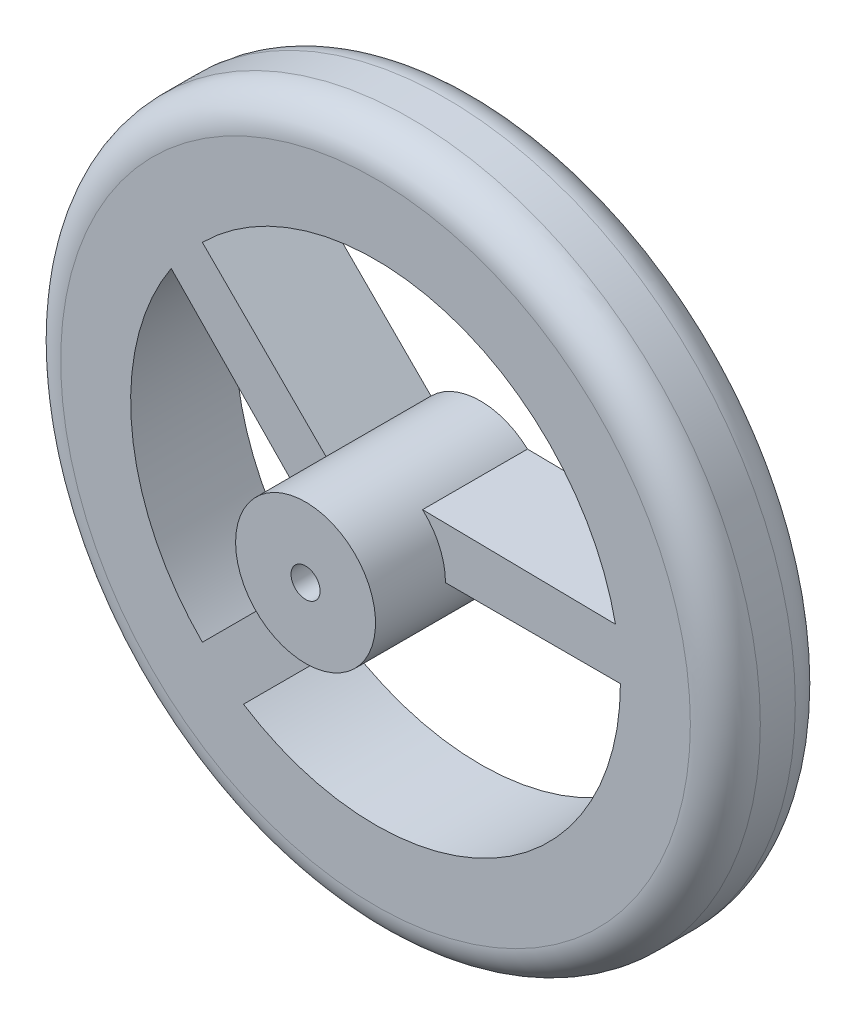
from build123d import *

# Parameters (mm, degrees)
SKETCH1_R           = 100
BOSS_EXTRUDE1_DEPTH = 30
FILLET2_R           = 10
SKETCH2_R           = 20
SKETCH2_R_2         = 4.15
BOSS_EXTRUDE2_DEPTH = 50
SCALE1_SCALE        = 0.05
SCALE2_SCALE        = 6


with BuildPart() as part:
    # Sketch1 → Boss-Extrude1 (new body)
    with BuildSketch(Plane.XY):
        Circle(SKETCH1_R)
        with BuildLine():
            Line((-10.606601718, -10.606601718), (-49.497474683, -49.497474683))
            ThreePointArc((-49.497474683, -49.497474683), (-69.64553071, -7.03562734), (-58.396917549, 38.597927675))
            Line((-58.396917549, 38.597927675), (-10.606601718, -10.606601718))
        make_face(mode=Mode.SUBTRACT)
        with BuildLine():
            ThreePointArc((10.606601718, -10.606601718), (13.858192988, -5.740251485), (15, 0))
            Line((15, 0), (70, 0))
            ThreePointArc((70, 0), (33.601511791, -61.407966954), (-37.741097297, -58.954300732))
            Line((-37.741097297, -58.954300732), (10.606601718, -10.606601718))
        make_face(mode=Mode.SUBTRACT)
        with BuildLine():
            ThreePointArc((0, 15), (-5.740251485, 13.858192988), (-10.606601718, 10.606601718))
            Line((-10.606601718, 10.606601718), (-49.497474683, 49.497474683))
            ThreePointArc((-49.497474683, 49.497474683), (20.152118643, 67.036498374), (68.585712798, 14))
            Line((68.585712798, 14), (0, 15))
        make_face(mode=Mode.SUBTRACT)
    extrude(amount=BOSS_EXTRUDE1_DEPTH)

    # Fillet2
    fillet2_edges = [part.edges().sort_by_distance(p)[0] for p in [
        (-100, 0, 0),
        (-100, 0, 30),
    ]]
    fillet(fillet2_edges, radius=FILLET2_R)

    # Sketch2 → Boss-Extrude2 (add)
    with BuildSketch(Plane(origin=(0, 0, 0), x_dir=(-1, 0, 0), z_dir=(0, 0, -1))):
        Circle(SKETCH2_R)
        Circle(SKETCH2_R_2, mode=Mode.SUBTRACT)
    extrude(amount=-BOSS_EXTRUDE2_DEPTH)


with BuildPart() as part_1:
    # Scale1: scaled about (-0.724367868, -0.188947022, 16.030178363)
    add(part.part.scale(SCALE1_SCALE).moved(Location((-0.688149475, -0.179499671, 15.228669445))))


with BuildPart() as part_2:
    # Scale2: scaled about (-0.724367868, -0.188947022, 16.030178363)
    add(part_1.part.scale(SCALE2_SCALE).moved(Location((3.62183934, 0.94473511, -80.150891815))))


solid = part_2.part
